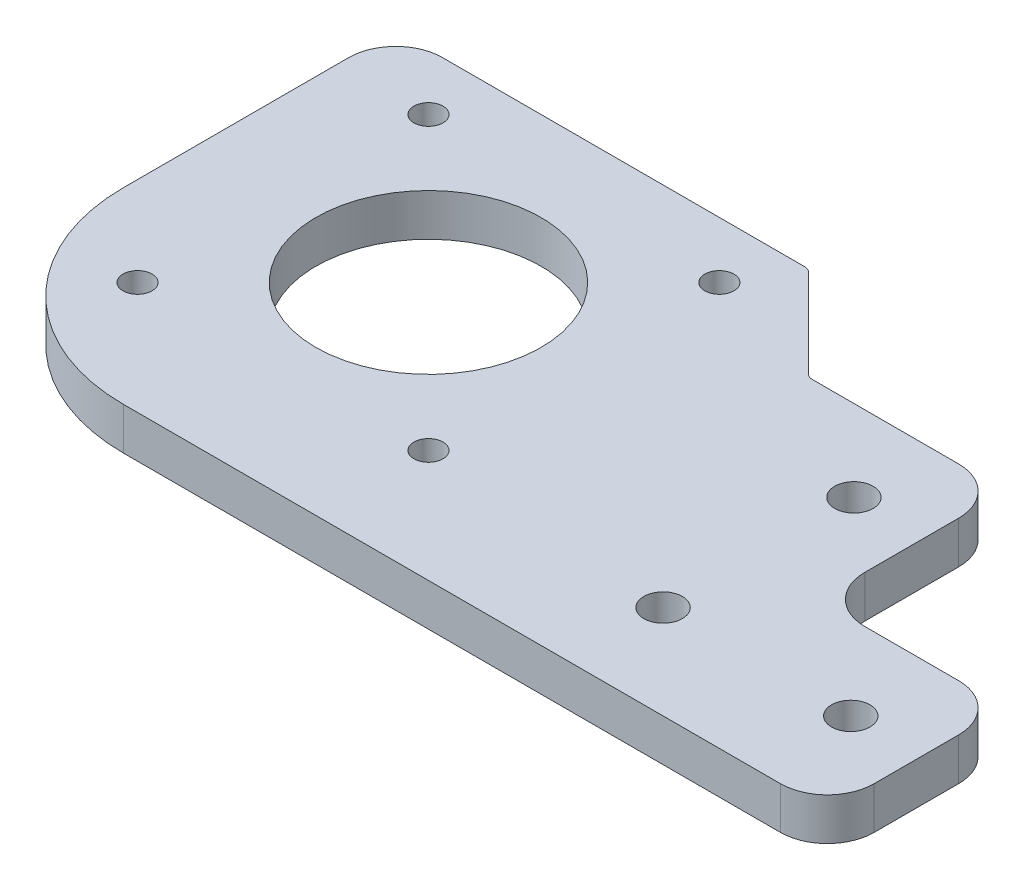
from build123d import *

# Parameters (mm, degrees)
SKETCH1_R           = 2.05
SKETCH1_R_2         = 12
SKETCH1_R_3         = 1.55
BOSS_EXTRUDE1_DEPTH = 4.5
FILLET1_R           = 20
FILLET2_R           = 5
FILLET3_R           = 1


with BuildPart() as part:
    # Sketch1 → Boss-Extrude1 (new body)
    with BuildSketch(Plane(origin=(0, 0, 0), x_dir=(1, 0, 0), z_dir=(0, 1, 0))):
        Polygon((0, 0), (-95, 0), (-95, 49), (-51, 49), (-41, 39), (-20, 39), (-20, 19), (0, 19), align=None)
        with Locations(Location((-7.5, 10, 0), (0, 0, 270))):
            Circle(SKETCH1_R, mode=Mode.SUBTRACT)
        with Locations(Location((-27.5, 10, 0), (0, 0, 270))):
            Circle(SKETCH1_R, mode=Mode.SUBTRACT)
        with Locations(Location((-27.5, 30.337245127, 0), (0, 0, 270))):
            Circle(SKETCH1_R, mode=Mode.SUBTRACT)
        with Locations(Location((-70, 27.5, 0), (0, 0, 270))):
            Circle(SKETCH1_R_2, mode=Mode.SUBTRACT)
        with Locations(Location((-85.5, 43, 0), (0, 0, 270))):
            Circle(SKETCH1_R_3, mode=Mode.SUBTRACT)
        with Locations(Location((-54.5, 43, 0), (0, 0, 270))):
            Circle(SKETCH1_R_3, mode=Mode.SUBTRACT)
        with Locations(Location((-85.5, 12, 0), (0, 0, 270))):
            Circle(SKETCH1_R_3, mode=Mode.SUBTRACT)
        with Locations(Location((-54.5, 12, 0), (0, 0, 270))):
            Circle(SKETCH1_R_3, mode=Mode.SUBTRACT)
    extrude(amount=BOSS_EXTRUDE1_DEPTH)

    # Fillet1
    fillet1_edges = [part.edges().sort_by_distance(p)[0] for p in [
        (-95, 2.25, 0),
    ]]
    fillet(fillet1_edges, radius=FILLET1_R)

    # Fillet2
    fillet2_edges = [part.edges().sort_by_distance(p)[0] for p in [
        (0, 2.25, 0),
        (-95, 2.25, -49),
        (-20, 2.25, -39),
        (-20, 2.25, -19),
        (0, 2.25, -19),
    ]]
    fillet(fillet2_edges, radius=FILLET2_R)

    # Fillet3
    fillet3_edges = [part.edges().sort_by_distance(p)[0] for p in [
        (-51, 2.25, -49),
        (-41, 2.25, -39),
    ]]
    fillet(fillet3_edges, radius=FILLET3_R)


solid = part.part
